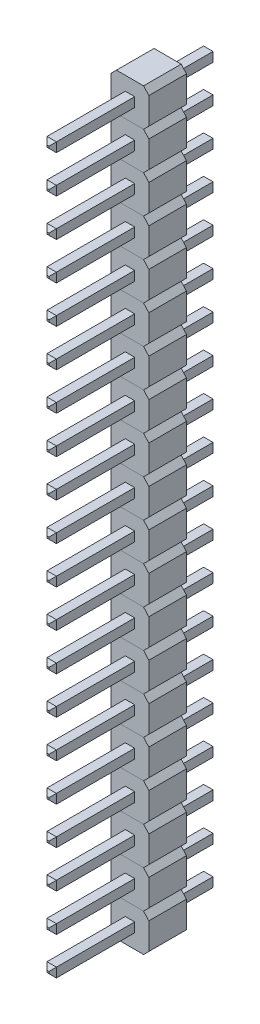
from build123d import *

# Parameters (mm, degrees)
PIN_DRAWING_W            = 0.636
PIN_DRAWING_H            = 0.636
BOSS_EXTRUDE1_DEPTH      = 2.54
BOSS_EXTRUDE2_DEPTH      = 5.5372
BOSS_EXTRUDE2_DEPTH_BACK = 5.5372
SKETCH1_W                = 0.636
SKETCH1_H                = 0.636
CHAMFER1_SIZE            = 0.25
LPATTERN2_COUNT          = 20
LPATTERN2_PITCH          = 2.54


with BuildPart() as part:
    # pin_drawing → Boss-Extrude1 (new body)
    with BuildSketch(Plane.XY):
        Polygon((-0.916946609, 1.25), (0.916946609, 1.25), (1.2705, 0.856446609), (1.2705, -0.936446609), (0.916946609, -1.29), (-0.916946609, -1.29), (-1.2705, -0.896446609), (-1.2705, 0.896446609), align=None)
        Rectangle(PIN_DRAWING_W, PIN_DRAWING_H, mode=Mode.SUBTRACT)
    extrude(amount=BOSS_EXTRUDE1_DEPTH)


with BuildPart() as body_2:
    # Sketch1 → Boss-Extrude2 (new, two sides: drawn at the far end of the back side and taken through both)
    with BuildSketch(Plane.XY.offset(2.54).offset(-BOSS_EXTRUDE2_DEPTH_BACK)):
        Rectangle(SKETCH1_W, SKETCH1_H)
    extrude(amount=BOSS_EXTRUDE2_DEPTH + BOSS_EXTRUDE2_DEPTH_BACK)

    # Chamfer1
    chamfer1_edges = [body_2.edges().sort_by_distance(p)[0] for p in [
        (0, 0.318, -2.9972),
        (0, -0.318, 8.0772),
        (0.318, 0, 8.0772),
        (-0.318, 0, -2.9972),
        (0, 0.318, 8.0772),
        (-0.318, 0, 8.0772),
        (0, -0.318, -2.9972),
        (0.318, 0, -2.9972),
    ]]
    chamfer(chamfer1_edges, length=CHAMFER1_SIZE)


with BuildPart() as lpattern2_1:
    # LPattern2: pattern copy
    add(part.part.moved(Location(Vector(0, -1, 0) * (1 * LPATTERN2_PITCH))))


with BuildPart() as lpattern2_2:
    # LPattern2: pattern copy
    add(part.part.moved(Location(Vector(0, -1, 0) * (2 * LPATTERN2_PITCH))))


with BuildPart() as lpattern2_3:
    # LPattern2: pattern copy
    add(part.part.moved(Location(Vector(0, -1, 0) * (3 * LPATTERN2_PITCH))))


with BuildPart() as lpattern2_4:
    # LPattern2: pattern copy
    add(part.part.moved(Location(Vector(0, -1, 0) * (4 * LPATTERN2_PITCH))))


with BuildPart() as lpattern2_5:
    # LPattern2: pattern copy
    add(part.part.moved(Location(Vector(0, -1, 0) * (5 * LPATTERN2_PITCH))))


with BuildPart() as lpattern2_6:
    # LPattern2: pattern copy
    add(part.part.moved(Location(Vector(0, -1, 0) * (6 * LPATTERN2_PITCH))))


with BuildPart() as lpattern2_7:
    # LPattern2: pattern copy
    add(part.part.moved(Location(Vector(0, -1, 0) * (7 * LPATTERN2_PITCH))))


with BuildPart() as lpattern2_8:
    # LPattern2: pattern copy
    add(part.part.moved(Location(Vector(0, -1, 0) * (8 * LPATTERN2_PITCH))))


with BuildPart() as lpattern2_9:
    # LPattern2: pattern copy
    add(part.part.moved(Location(Vector(0, -1, 0) * (9 * LPATTERN2_PITCH))))


with BuildPart() as lpattern2_10:
    # LPattern2: pattern copy
    add(part.part.moved(Location(Vector(0, -1, 0) * (10 * LPATTERN2_PITCH))))


with BuildPart() as lpattern2_11:
    # LPattern2: pattern copy
    add(part.part.moved(Location(Vector(0, -1, 0) * (11 * LPATTERN2_PITCH))))


with BuildPart() as lpattern2_12:
    # LPattern2: pattern copy
    add(part.part.moved(Location(Vector(0, -1, 0) * (12 * LPATTERN2_PITCH))))


with BuildPart() as lpattern2_13:
    # LPattern2: pattern copy
    add(part.part.moved(Location(Vector(0, -1, 0) * (13 * LPATTERN2_PITCH))))


with BuildPart() as lpattern2_14:
    # LPattern2: pattern copy
    add(part.part.moved(Location(Vector(0, -1, 0) * (14 * LPATTERN2_PITCH))))


with BuildPart() as lpattern2_15:
    # LPattern2: pattern copy
    add(part.part.moved(Location(Vector(0, -1, 0) * (15 * LPATTERN2_PITCH))))


with BuildPart() as lpattern2_16:
    # LPattern2: pattern copy
    add(part.part.moved(Location(Vector(0, -1, 0) * (16 * LPATTERN2_PITCH))))


with BuildPart() as lpattern2_17:
    # LPattern2: pattern copy
    add(part.part.moved(Location(Vector(0, -1, 0) * (17 * LPATTERN2_PITCH))))


with BuildPart() as lpattern2_18:
    # LPattern2: pattern copy
    add(part.part.moved(Location(Vector(0, -1, 0) * (18 * LPATTERN2_PITCH))))


with BuildPart() as lpattern2_19:
    # LPattern2: pattern copy
    add(part.part.moved(Location(Vector(0, -1, 0) * (19 * LPATTERN2_PITCH))))


with BuildPart() as lpattern2_20:
    # LPattern2: pattern copy
    add(body_2.part.moved(Location(Vector(0, -1, 0) * (1 * LPATTERN2_PITCH))))


with BuildPart() as lpattern2_21:
    # LPattern2: pattern copy
    add(body_2.part.moved(Location(Vector(0, -1, 0) * (2 * LPATTERN2_PITCH))))


with BuildPart() as lpattern2_22:
    # LPattern2: pattern copy
    add(body_2.part.moved(Location(Vector(0, -1, 0) * (3 * LPATTERN2_PITCH))))


with BuildPart() as lpattern2_23:
    # LPattern2: pattern copy
    add(body_2.part.moved(Location(Vector(0, -1, 0) * (4 * LPATTERN2_PITCH))))


with BuildPart() as lpattern2_24:
    # LPattern2: pattern copy
    add(body_2.part.moved(Location(Vector(0, -1, 0) * (5 * LPATTERN2_PITCH))))


with BuildPart() as lpattern2_25:
    # LPattern2: pattern copy
    add(body_2.part.moved(Location(Vector(0, -1, 0) * (6 * LPATTERN2_PITCH))))


with BuildPart() as lpattern2_26:
    # LPattern2: pattern copy
    add(body_2.part.moved(Location(Vector(0, -1, 0) * (7 * LPATTERN2_PITCH))))


with BuildPart() as lpattern2_27:
    # LPattern2: pattern copy
    add(body_2.part.moved(Location(Vector(0, -1, 0) * (8 * LPATTERN2_PITCH))))


with BuildPart() as lpattern2_28:
    # LPattern2: pattern copy
    add(body_2.part.moved(Location(Vector(0, -1, 0) * (9 * LPATTERN2_PITCH))))


with BuildPart() as lpattern2_29:
    # LPattern2: pattern copy
    add(body_2.part.moved(Location(Vector(0, -1, 0) * (10 * LPATTERN2_PITCH))))


with BuildPart() as lpattern2_30:
    # LPattern2: pattern copy
    add(body_2.part.moved(Location(Vector(0, -1, 0) * (11 * LPATTERN2_PITCH))))


with BuildPart() as lpattern2_31:
    # LPattern2: pattern copy
    add(body_2.part.moved(Location(Vector(0, -1, 0) * (12 * LPATTERN2_PITCH))))


with BuildPart() as lpattern2_32:
    # LPattern2: pattern copy
    add(body_2.part.moved(Location(Vector(0, -1, 0) * (13 * LPATTERN2_PITCH))))


with BuildPart() as lpattern2_33:
    # LPattern2: pattern copy
    add(body_2.part.moved(Location(Vector(0, -1, 0) * (14 * LPATTERN2_PITCH))))


with BuildPart() as lpattern2_34:
    # LPattern2: pattern copy
    add(body_2.part.moved(Location(Vector(0, -1, 0) * (15 * LPATTERN2_PITCH))))


with BuildPart() as lpattern2_35:
    # LPattern2: pattern copy
    add(body_2.part.moved(Location(Vector(0, -1, 0) * (16 * LPATTERN2_PITCH))))


with BuildPart() as lpattern2_36:
    # LPattern2: pattern copy
    add(body_2.part.moved(Location(Vector(0, -1, 0) * (17 * LPATTERN2_PITCH))))


with BuildPart() as lpattern2_37:
    # LPattern2: pattern copy
    add(body_2.part.moved(Location(Vector(0, -1, 0) * (18 * LPATTERN2_PITCH))))


with BuildPart() as lpattern2_38:
    # LPattern2: pattern copy
    add(body_2.part.moved(Location(Vector(0, -1, 0) * (19 * LPATTERN2_PITCH))))


solid = Compound([part.part, body_2.part, lpattern2_1.part, lpattern2_2.part, lpattern2_3.part, lpattern2_4.part, lpattern2_5.part, lpattern2_6.part, lpattern2_7.part, lpattern2_8.part, lpattern2_9.part, lpattern2_10.part, lpattern2_11.part, lpattern2_12.part, lpattern2_13.part, lpattern2_14.part, lpattern2_15.part, lpattern2_16.part, lpattern2_17.part, lpattern2_18.part, lpattern2_19.part, lpattern2_20.part, lpattern2_21.part, lpattern2_22.part, lpattern2_23.part, lpattern2_24.part, lpattern2_25.part, lpattern2_26.part, lpattern2_27.part, lpattern2_28.part, lpattern2_29.part, lpattern2_30.part, lpattern2_31.part, lpattern2_32.part, lpattern2_33.part, lpattern2_34.part, lpattern2_35.part, lpattern2_36.part, lpattern2_37.part, lpattern2_38.part])
